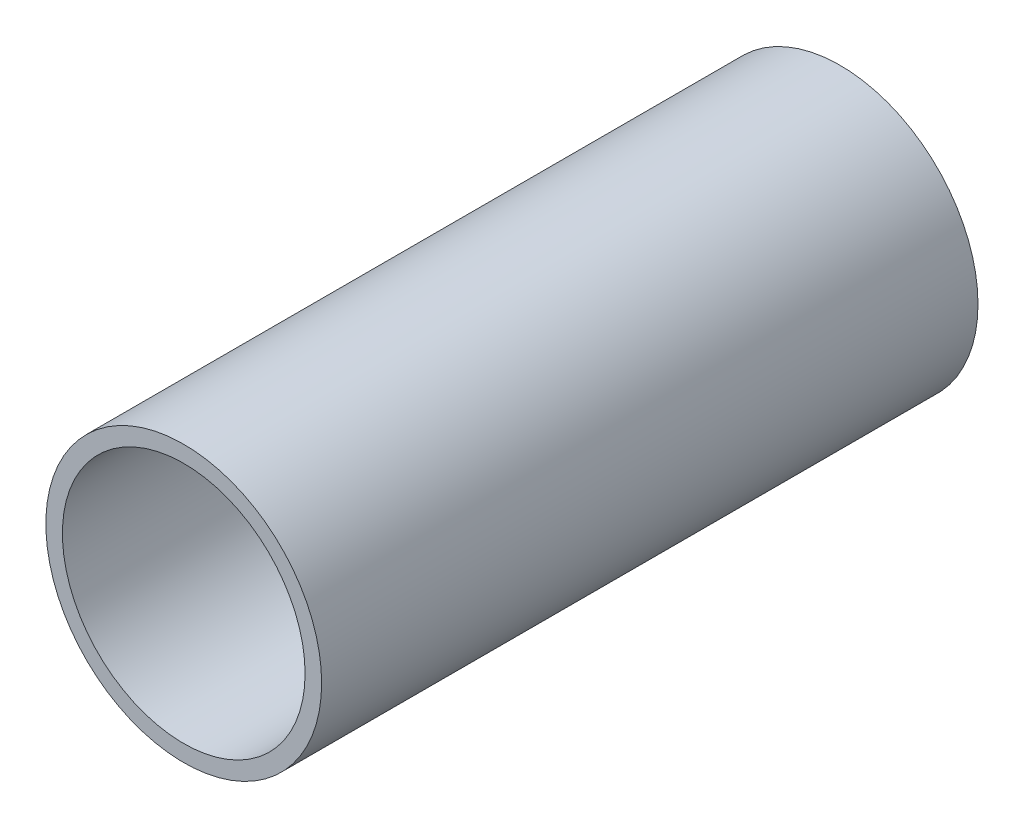
from build123d import *

# Parameters (mm, degrees)
SKETCH1_R           = 6.35
SKETCH1_R_2         = 5.588
BOSS_EXTRUDE1_DEPTH = 30.226


with BuildPart() as part:
    # Sketch1 → Boss-Extrude1 (new body)
    with BuildSketch(Plane.XY):
        Circle(SKETCH1_R)
        Circle(SKETCH1_R_2, mode=Mode.SUBTRACT)
    extrude(amount=BOSS_EXTRUDE1_DEPTH)


solid = part.part
